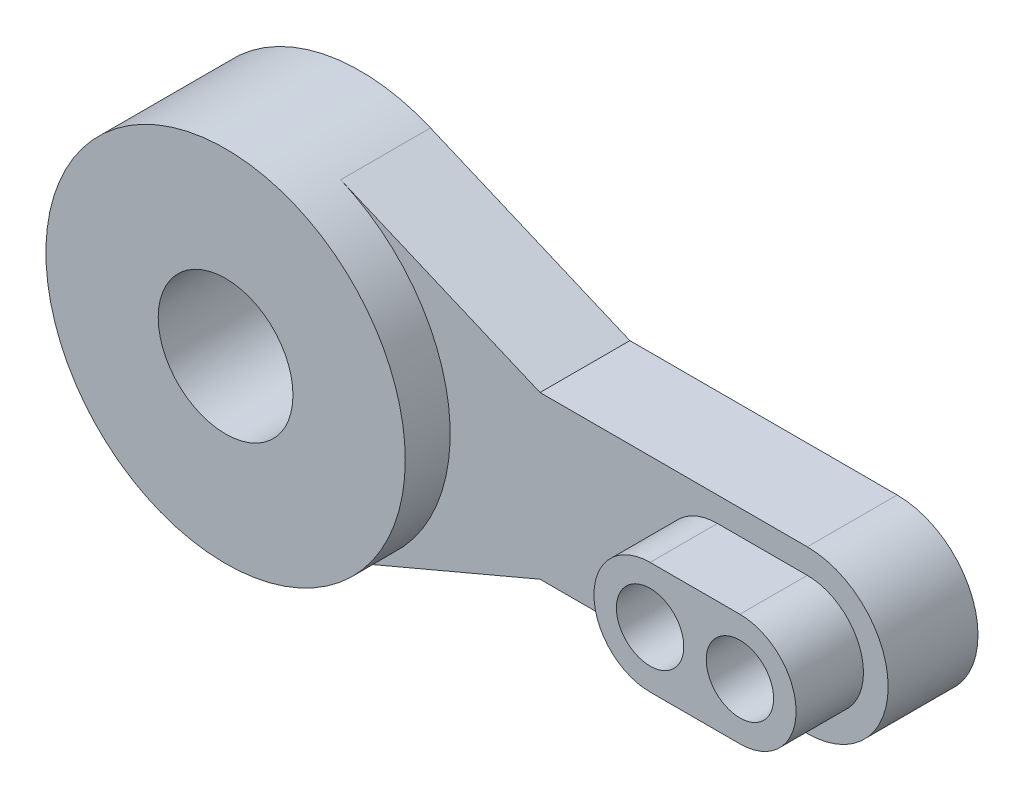
from build123d import *
from build123d.topology import SkipClean

# Parameters (mm, degrees)
BOSS_EXTRUDE1_DEPTH      = 4
SKETCH4_R                = 8
BOSS_EXTRUDE2_DEPTH      = 2
BOSS_EXTRUDE3_DEPTH      = 3
F_3_0_3_DIAMETER_HOLE1_D = 3
F_6_0_6_DIAMETER_HOLE1_D = 6


with BuildPart() as part:
    # Sketch1 → Boss-Extrude1 (new body)
    with BuildSketch(Plane.XY):
        with BuildLine():
            Line((3.123869731, 7.364878676), (12, 3.6))
            Line((12, 3.6), (23.9, 3.6))
            ThreePointArc((23.9, 3.6), (27.5, 0), (23.9, -3.6))
            Line((23.9, -3.6), (12, -3.6))
            Line((12, -3.6), (3.123869731, -7.364878676))
            ThreePointArc((3.123869731, -7.364878676), (-8, 0), (3.123869731, 7.364878676))
        make_face()
    extrude(amount=BOSS_EXTRUDE1_DEPTH)

    # Sketch4 → Boss-Extrude2 (add)
    with SkipClean():  # the faces are left unmerged after this step: merging them gives an invalid solid
        with BuildSketch(Plane.XY.offset(4)):
            with Locations(Location((0, 0, 0), (0, 0, 67.015399011))):
                Circle(SKETCH4_R)
        extrude(amount=BOSS_EXTRUDE2_DEPTH)

    # Sketch5 → Boss-Extrude3 (add)
    with SkipClean():  # the faces are left unmerged after this step: merging them gives an invalid solid
        with BuildSketch(Plane.XY.offset(4)):
            with BuildLine():
                Line((23.9, -2.5), (19.9, -2.5))
                ThreePointArc((19.9, -2.5), (17.4, 0), (19.9, 2.5))
                Line((19.9, 2.5), (23.9, 2.5))
                ThreePointArc((23.9, 2.5), (26.4, 0), (23.9, -2.5))
            make_face()
        extrude(amount=BOSS_EXTRUDE3_DEPTH)

    # Ø3.0 (3) Diameter Hole1 (through all)
    with Locations(Plane(origin=(0, 0, 0), x_dir=(-1, 0, 0), z_dir=(0, 0, -1))):
        with Locations((-23.9, 0), (-19.9, 0)):
            Hole(F_3_0_3_DIAMETER_HOLE1_D / 2)

    # Ø6.0 (6) Diameter Hole1 (through all)
    with Locations(Plane(origin=(0, 0, 0), x_dir=(-1, 0, 0), z_dir=(0, 0, -1))):
        with Locations((0, 0)):
            Hole(F_6_0_6_DIAMETER_HOLE1_D / 2)


solid = part.part
